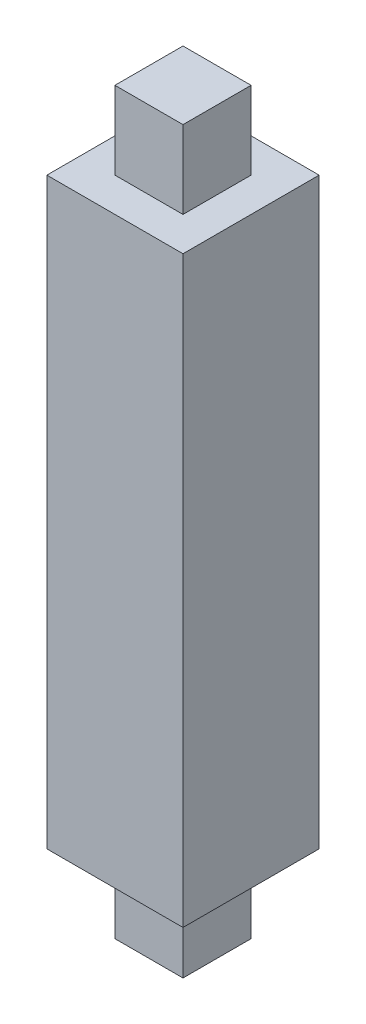
from build123d import *

# Parameters (mm, degrees)
SKETCH1_W           = 7
SKETCH1_H           = 7
BOSS_EXTRUDE1_DEPTH = 15
SKETCH2_W           = 3.5
SKETCH2_H           = 3.5
BOSS_EXTRUDE2_DEPTH = 4
SKETCH3_W           = 3.5
SKETCH3_H           = 3.5
BOSS_EXTRUDE3_DEPTH = 4


with BuildPart() as part:
    # Sketch1 → Boss-Extrude1 (new, symmetric)
    with BuildSketch(Plane(origin=(0, 0, 0), x_dir=(1, 0, 0), z_dir=(0, 1, 0))):
        Rectangle(SKETCH1_W, SKETCH1_H)
    extrude(amount=BOSS_EXTRUDE1_DEPTH, both=True)

    # Sketch2 → Boss-Extrude2 (add)
    with BuildSketch(Plane(origin=(0, 15, 0), x_dir=(1, 0, 0), z_dir=(0, 1, 0))):
        Rectangle(SKETCH2_W, SKETCH2_H)
    extrude(amount=BOSS_EXTRUDE2_DEPTH)

    # Sketch3 → Boss-Extrude3 (add)
    with BuildSketch(Plane.XZ.offset(15)):
        Rectangle(SKETCH3_W, SKETCH3_H)
    extrude(amount=BOSS_EXTRUDE3_DEPTH)


solid = part.part
